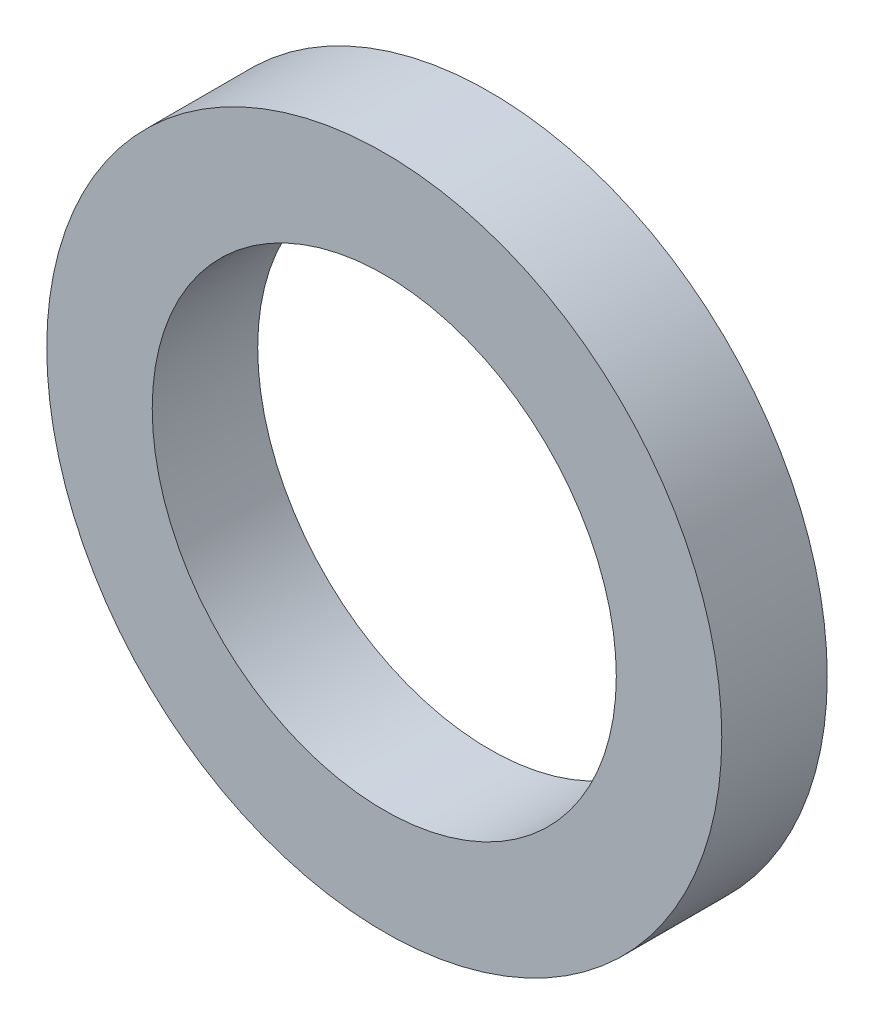
from build123d import *

# Parameters (mm, degrees)
SKETCH1_R           = 8
SKETCH1_R_2         = 5.5
BOSS_EXTRUDE1_DEPTH = 2.5


with BuildPart() as part:
    # Sketch1 → Boss-Extrude1 (new body)
    with BuildSketch(Plane.XY):
        Circle(SKETCH1_R)
        Circle(SKETCH1_R_2, mode=Mode.SUBTRACT)
    extrude(amount=BOSS_EXTRUDE1_DEPTH)


solid = part.part
